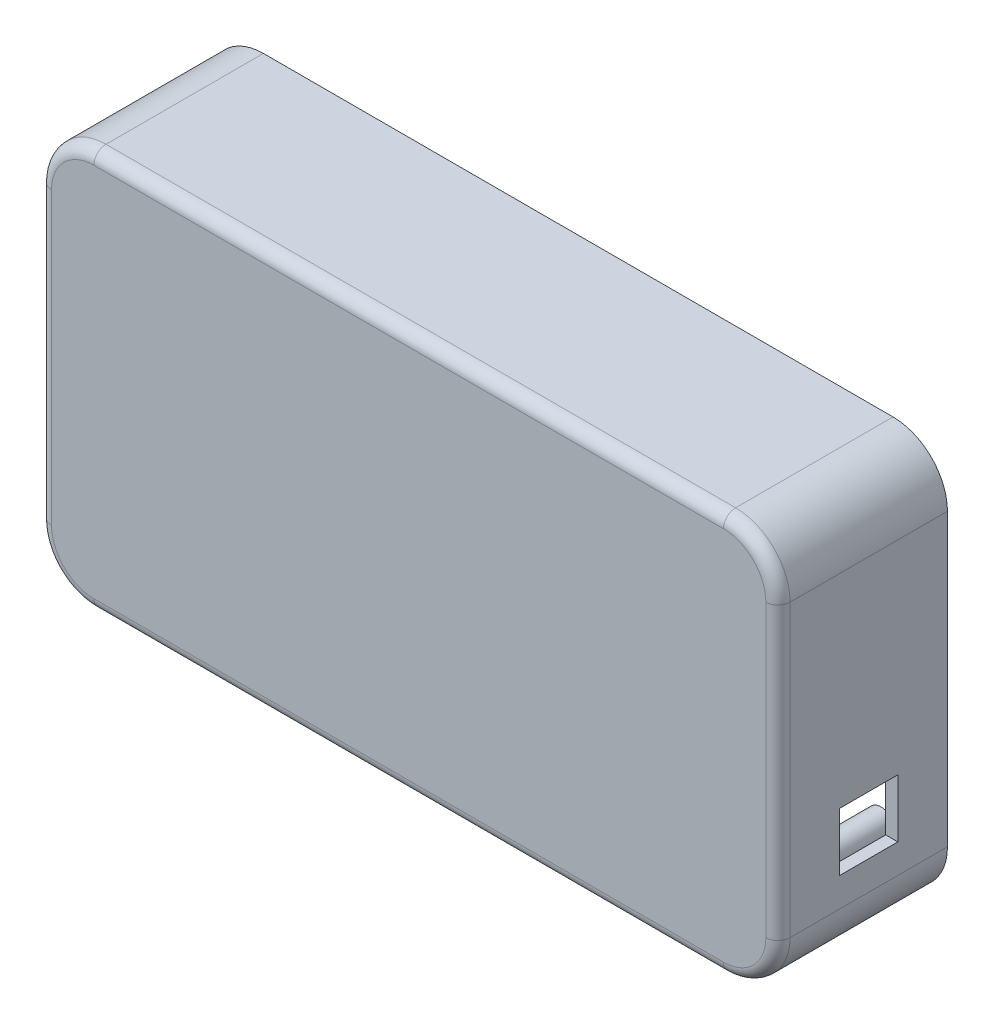
from build123d import *

# Parameters (mm, degrees)
EXTRUDE_1_DEPTH        = 70
SKETCH_1_4_R           = 5.55
CUT_EXTRUDE_1_DEPTH    = 65
CUT_EXTRUDE_2_DEPTH    = 5
SKETCH_1_6_R           = 5.55
SKETCH_1_6_R_2         = 2.55
CUT_EXTRUDE_3_DEPTH    = 5
SKETCH_1_7_R           = 2.55
CUT_EXTRUDE_4_DEPTH    = 40
SKETCH_1_8_R           = 2.55
CUT_EXTRUDE_5_DEPTH    = 40
SKETCH_1_10_R          = 2.55
CUT_EXTRUDE_6_DEPTH    = 40
SKETCH_1_11_R          = 2.55
CUT_EXTRUDE_7_DEPTH    = 40
SKETCH_1_12_R          = 5.55
SKETCH_1_12_R_2        = 2.55
CUT_EXTRUDE_8_DEPTH    = 5
SKETCH_1_13_R          = 5.55
SKETCH_1_13_R_2        = 2.55
CUT_EXTRUDE_9_DEPTH    = 5
SKETCH_1_14_R          = 5.55
SKETCH_1_14_R_2        = 2.55
CUT_EXTRUDE_10_DEPTH   = 5
FILLET_2_R             = 5
SKETCH_14_R            = 1.6
SKETCH_14_W            = 12
SKETCH_14_H            = 7
CUT_EXTRUDE_11_DEPTH   = 5
SKETCH_16_W            = 24
SKETCH_16_H            = 24
CUT_EXTRUDE_12_DEPTH   = 5
SKETCH_18_W            = 24
SKETCH_18_H            = 24
CUT_EXTRUDE_13_DEPTH   = 5
EXTRUDE_2_DEPTH        = 60
SKETCH_28_W            = 0.62195122
SKETCH_28_H            = 3
CUT_EXTRUDE_4121_DEPTH = 1
SKETCH_29_W            = 28.7
SKETCH_29_H            = 26.7
SKETCH_29_W_2          = 25.7
SKETCH_29_H_2          = 23.7
EXTRUDE_3_DEPTH        = 2
SKETCH_29_4_R          = 3
SKETCH_29_4_R_2        = 1.1
EXTRUDE_4_DEPTH        = 5
SKETCH_29_5_R          = 3.1
SKETCH_29_5_R_2        = 1.1
EXTRUDE_5_DEPTH        = 6.5


with BuildPart() as part:
    # 草图1 → 凸台-拉伸1 (new body)
    with BuildSketch(Plane.XY):
        with BuildLine():
            Line((-130, 82.5), (130, 82.5))
            ThreePointArc((130, 82.5), (145.909902577, 75.909902577), (152.5, 60))
            Line((152.5, 60), (152.5, -60))
            ThreePointArc((152.5, -60), (145.909902577, -75.909902577), (130, -82.5))
            Line((130, -82.5), (-130, -82.5))
            ThreePointArc((-130, -82.5), (-145.909902577, -75.909902577), (-152.5, -60))
            Line((-152.5, -60), (-152.5, 60))
            ThreePointArc((-152.5, 60), (-145.909902577, 75.909902577), (-130, 82.5))
        make_face()
    extrude(amount=EXTRUDE_1_DEPTH)

    # 草图1<4> → 切除-拉伸1 (cut)
    with BuildSketch(Plane.XY):
        with BuildLine():
            Line((130, 77.5), (-130, 77.5))
            ThreePointArc((-130, 77.5), (-142.374368671, 72.374368671), (-147.5, 60))
            Line((-147.5, 60), (-147.5, -60))
            ThreePointArc((-147.5, -60), (-142.374368671, -72.374368671), (-130, -77.5))
            Line((-130, -77.5), (130, -77.5))
            ThreePointArc((130, -77.5), (142.374368671, -72.374368671), (147.5, -60))
            Line((147.5, -60), (147.5, 60))
            ThreePointArc((147.5, 60), (142.374368671, 72.374368671), (130, 77.5))
        make_face()
        with Locations((-130, -60)):
            Circle(SKETCH_1_4_R, mode=Mode.SUBTRACT)
        with Locations((130, -60)):
            Circle(SKETCH_1_4_R, mode=Mode.SUBTRACT)
        with Locations((-130, 60)):
            Circle(SKETCH_1_4_R, mode=Mode.SUBTRACT)
        with Locations((130, 60)):
            Circle(SKETCH_1_4_R, mode=Mode.SUBTRACT)
    extrude(amount=CUT_EXTRUDE_1_DEPTH, mode=Mode.SUBTRACT)

    # 草图1<5> → 切除-拉伸2 (cut)
    with BuildSketch(Plane.XY):
        with BuildLine():
            ThreePointArc((-130, 80.2), (-144.28355698, 74.28355698), (-150.2, 60))
            Line((-150.2, 60), (-150.2, -60))
            ThreePointArc((-150.2, -60), (-144.28355698, -74.28355698), (-130, -80.2))
            Line((-130, -80.2), (130, -80.2))
            ThreePointArc((130, -80.2), (144.28355698, -74.28355698), (150.2, -60))
            Line((150.2, -60), (150.2, 60))
            ThreePointArc((150.2, 60), (144.28355698, 74.28355698), (130, 80.2))
            Line((130, 80.2), (-130, 80.2))
        make_face()
        with BuildLine():
            ThreePointArc((-147.5, 60), (-142.374368671, 72.374368671), (-130, 77.5))
            Line((-130, 77.5), (130, 77.5))
            ThreePointArc((130, 77.5), (142.374368671, 72.374368671), (147.5, 60))
            Line((147.5, 60), (147.5, -60))
            ThreePointArc((147.5, -60), (142.374368671, -72.374368671), (130, -77.5))
            Line((130, -77.5), (-130, -77.5))
            ThreePointArc((-130, -77.5), (-142.374368671, -72.374368671), (-147.5, -60))
            Line((-147.5, -60), (-147.5, 60))
        make_face(mode=Mode.SUBTRACT)
    extrude(amount=CUT_EXTRUDE_2_DEPTH, mode=Mode.SUBTRACT)

    # 草图1<6> → 切除-拉伸3 (cut)
    with BuildSketch(Plane.XY):
        with Locations((130, 60)):
            Circle(SKETCH_1_6_R)
        with Locations((130, 60)):
            Circle(SKETCH_1_6_R_2, mode=Mode.SUBTRACT)
    extrude(amount=CUT_EXTRUDE_3_DEPTH, mode=Mode.SUBTRACT)

    # 草图1<7> → 切除-拉伸4 (cut)
    with BuildSketch(Plane.XY):
        with Locations((130, 60)):
            Circle(SKETCH_1_7_R)
    extrude(amount=CUT_EXTRUDE_4_DEPTH, mode=Mode.SUBTRACT)

    # 草图1<8> → 切除-拉伸5 (cut)
    with BuildSketch(Plane.XY):
        with Locations((130, -60)):
            Circle(SKETCH_1_8_R)
    extrude(amount=CUT_EXTRUDE_5_DEPTH, mode=Mode.SUBTRACT)

    # 草图1<10> → 切除-拉伸6 (cut)
    with BuildSketch(Plane.XY):
        with Locations((-130, -60)):
            Circle(SKETCH_1_10_R)
    extrude(amount=CUT_EXTRUDE_6_DEPTH, mode=Mode.SUBTRACT)

    # 草图1<11> → 切除-拉伸7 (cut)
    with BuildSketch(Plane.XY):
        with Locations((-130, 60)):
            Circle(SKETCH_1_11_R)
    extrude(amount=CUT_EXTRUDE_7_DEPTH, mode=Mode.SUBTRACT)

    # 草图1<12> → 切除-拉伸8 (cut)
    with BuildSketch(Plane.XY):
        with Locations((-130, 60)):
            Circle(SKETCH_1_12_R)
        with Locations((-130, 60)):
            Circle(SKETCH_1_12_R_2, mode=Mode.SUBTRACT)
    extrude(amount=CUT_EXTRUDE_8_DEPTH, mode=Mode.SUBTRACT)

    # 草图1<13> → 切除-拉伸9 (cut)
    with BuildSketch(Plane.XY):
        with Locations((-130, -60)):
            Circle(SKETCH_1_13_R)
        with Locations((-130, -60)):
            Circle(SKETCH_1_13_R_2, mode=Mode.SUBTRACT)
    extrude(amount=CUT_EXTRUDE_9_DEPTH, mode=Mode.SUBTRACT)

    # 草图1<14> → 切除-拉伸10 (cut)
    with BuildSketch(Plane.XY):
        with Locations((130, -60)):
            Circle(SKETCH_1_14_R)
        with Locations((130, -60)):
            Circle(SKETCH_1_14_R_2, mode=Mode.SUBTRACT)
    extrude(amount=CUT_EXTRUDE_10_DEPTH, mode=Mode.SUBTRACT)

    # 圆角2
    fillet_2_edges = [part.edges().sort_by_distance(p)[0] for p in [
        (-152.5, 0, 70),
        (0, -82.5, 70),
        (152.5, 0, 70),
        (0, 82.5, 70),
    ]]
    fillet(fillet_2_edges, radius=FILLET_2_R)

    # 草图14 → 切除-拉伸11 (cut)
    with BuildSketch(Plane.XZ.offset(82.5)):
        with Locations((9, 58)):
            Circle(SKETCH_14_R)
        with Locations((-9, 58)):
            Circle(SKETCH_14_R)
        with Locations((0, 58)):
            Rectangle(SKETCH_14_W, SKETCH_14_H)
    extrude(amount=-CUT_EXTRUDE_11_DEPTH, mode=Mode.SUBTRACT)

    # 草图16 → 切除-拉伸12 (cut)
    with BuildSketch(Plane(origin=(152.5, 0, 0), x_dir=(0, 0, -1), z_dir=(1, 0, 0))):
        with Locations((-32.5, -36)):
            Rectangle(SKETCH_16_W, SKETCH_16_H)
    extrude(amount=-CUT_EXTRUDE_12_DEPTH, mode=Mode.SUBTRACT)

    # 草图18 → 切除-拉伸13 (cut)
    with BuildSketch(Plane.ZY.offset(152.5)):
        with Locations((32.5, -36)):
            Rectangle(SKETCH_18_W, SKETCH_18_H)
    extrude(amount=-CUT_EXTRUDE_13_DEPTH, mode=Mode.SUBTRACT)

    # 草图19 → 凸台-拉伸2 (add)
    with BuildSketch(Plane(origin=(0, 0, 65), x_dir=(-1, 0, 0), z_dir=(0, 0, -1))):
        with BuildLine():
            Line((-103, 40), (-18, 40))
            ThreePointArc((-18, 40), (-14, 36), (-18, 32))
            Line((-18, 32), (-103, 32))
            ThreePointArc((-103, 32), (-107, 36), (-103, 40))
        make_face()
        with BuildLine():
            Line((103, 40), (18, 40))
            ThreePointArc((18, 40), (14, 36), (18, 32))
            Line((18, 32), (103, 32))
            ThreePointArc((103, 32), (107, 36), (103, 40))
        make_face()
        with BuildLine():
            Line((-103, -20), (-23, -20))
            ThreePointArc((-23, -20), (-19, -24), (-23, -28))
            Line((-23, -28), (-103, -28))
            ThreePointArc((-103, -28), (-107, -24), (-103, -20))
        make_face()
        with BuildLine():
            Line((103, -20), (23, -20))
            ThreePointArc((23, -20), (19, -24), (23, -28))
            Line((23, -28), (103, -28))
            ThreePointArc((103, -28), (107, -24), (103, -20))
        make_face()
    extrude(amount=EXTRUDE_2_DEPTH)

    # 草图28 → Cut-Extrude 4121 (cut)
    # profile 1 of 6: a face of its own
    with BuildSketch(Plane(origin=(0, 0, 5), x_dir=(-1, 0, 0), z_dir=(0, 0, -1))):
        with BuildLine():
            Line((71.743902439, -23.06097561), (71.743902439, -22))
            Line((71.743902439, -22), (72.402439024, -22))
            Line((72.402439024, -22), (72.402439024, -25))
            Line((72.402439024, -25), (71.366615854, -25))
            add(Edge.make_bspline(
                [(71.366615854, -25), (71.321235516, -24.999503633), (71.233367687, -24.99854254), (71.106060544, -24.986562483), (70.987337132, -24.968820048), (70.877181936, -24.943151197), (70.775581487, -24.910343596), (70.683056103, -24.869429025), (70.598654541, -24.822319695), (70.524024812, -24.766238818), (70.457535573, -24.70359415), (70.399890652, -24.633409047), (70.351643157, -24.555403322), (70.312118811, -24.470154314), (70.281102248, -24.377583496), (70.259827547, -24.277464991), (70.246454511, -24.170330476), (70.244768718, -24.096458902), (70.243902439, -24.058498476)],
                knots=[0, 0, 0, 0, 1.298309684, 2.513856393, 3.656108695, 4.731525363, 5.747269452, 6.706842141, 7.622696522, 8.50723259, 9.371308978, 10.231556582, 11.09863924, 11.989139744, 12.915198226, 13.88644584, 14.913906774, 16, 16, 16, 16], degree=3))
            add(Edge.make_bspline(
                [(70.243902439, -24.058498476), (70.244769405, -24.021272958), (70.246467359, -23.948366695), (70.263337433, -23.842163665), (70.288441674, -23.740985732), (70.326073247, -23.646083274), (70.373267335, -23.556331972), (70.431224137, -23.472633969), (70.500132787, -23.395013177), (70.578100814, -23.323395194), (70.66409143, -23.259035564), (70.756348979, -23.203590213), (70.853782678, -23.156921785), (70.956335147, -23.119131351), (71.06429291, -23.090548423), (71.177535592, -23.071210485), (71.295911317, -23.060851645), (71.376505344, -23.060933819), (71.417492378, -23.06097561)],
                knots=[0, 0, 0, 0, 1.030031435, 2.017318961, 2.9707634, 3.911434012, 4.836705747, 5.773461207, 6.723043161, 7.705184701, 8.700351159, 9.692154612, 10.681034209, 11.68770297, 12.714187277, 13.76904456, 14.865421547, 16, 16, 16, 16], degree=3))
            Line((71.417492378, -23.06097561), (71.743902439, -23.06097561))
        make_face()
        with BuildLine():
            Line((71.761051829, -24.524390244), (71.761051829, -23.536585366))
            Line((71.761051829, -23.536585366), (71.47808689, -23.536585366))
            add(Edge.make_bspline(
                [(71.47808689, -23.536585366), (71.45482084, -23.536778598), (71.40972001, -23.537153174), (71.344465291, -23.543899544), (71.283444982, -23.553252093), (71.227085634, -23.566981838), (71.174809955, -23.583961658), (71.127554347, -23.605656177), (71.084616512, -23.631110707), (71.045811993, -23.66020658), (71.012369871, -23.694182881), (70.982530002, -23.731325445), (70.957217351, -23.772482976), (70.937630493, -23.818149594), (70.921074649, -23.86693942), (70.910829478, -23.92001949), (70.903580084, -23.97674328), (70.902827123, -24.015980331), (70.902439024, -24.036204268)],
                knots=[0, 0, 0, 0, 1.278264899, 2.477894098, 3.602370215, 4.669373304, 5.663063542, 6.619223296, 7.520996807, 8.402964925, 9.276935434, 10.134111266, 11.017943356, 11.922995833, 12.86038281, 13.844364746, 14.88892179, 16, 16, 16, 16], degree=3))
            add(Edge.make_bspline(
                [(70.902439024, -24.036204268), (70.902841845, -24.055853896), (70.903626626, -24.094135534), (70.910737268, -24.14956841), (70.921397479, -24.2015033), (70.936606653, -24.249559353), (70.956924182, -24.293637792), (70.98167517, -24.333929433), (71.010654257, -24.370630426), (71.044706059, -24.402947478), (71.082167237, -24.432460876), (71.125226736, -24.456841362), (71.172201914, -24.478173977), (71.223803805, -24.495139779), (71.279703169, -24.508144403), (71.339844971, -24.517877805), (71.404613583, -24.523603352), (71.449302272, -24.524122343), (71.472370427, -24.524390244)],
                knots=[0, 0, 0, 0, 1.096807385, 2.136813243, 3.115574441, 4.054422268, 4.94474187, 5.818891163, 6.689666352, 7.547538513, 8.435055958, 9.345744162, 10.302983784, 11.312439221, 12.373194966, 13.505006157, 14.712092391, 16, 16, 16, 16], degree=3))
            Line((71.472370427, -24.524390244), (71.761051829, -24.524390244))
        make_face(mode=Mode.SUBTRACT)
    # profile 2 of 6: a face of its own
    with BuildSketch(Plane(origin=(0, 0, 5), x_dir=(-1, 0, 0), z_dir=(0, 0, -1))):
        with BuildLine():
            Line((67.975609756, -23.06097561), (67.975609756, -22))
            Line((67.975609756, -22), (68.634146341, -22))
            Line((68.634146341, -22), (68.634146341, -25))
            Line((68.634146341, -25), (67.598323171, -25))
            add(Edge.make_bspline(
                [(67.598323171, -25), (67.552942833, -24.999503633), (67.465075004, -24.99854254), (67.337767861, -24.986562483), (67.219044449, -24.968820048), (67.108889254, -24.943151197), (67.007288804, -24.910343596), (66.914763421, -24.869429025), (66.830361858, -24.822319695), (66.755732129, -24.766238818), (66.68924289, -24.70359415), (66.631597969, -24.633409047), (66.583350475, -24.555403322), (66.543826128, -24.470154314), (66.512809566, -24.377583496), (66.491534864, -24.277464991), (66.478161828, -24.170330476), (66.476476035, -24.096458902), (66.475609756, -24.058498476)],
                knots=[0, 0, 0, 0, 1.298309684, 2.513856393, 3.656108695, 4.731525363, 5.747269452, 6.706842141, 7.622696522, 8.50723259, 9.371308978, 10.231556582, 11.09863924, 11.989139744, 12.915198226, 13.88644584, 14.913906774, 16, 16, 16, 16], degree=3))
            add(Edge.make_bspline(
                [(66.475609756, -24.058498476), (66.476476722, -24.021272958), (66.478174676, -23.948366695), (66.49504475, -23.842163665), (66.520148991, -23.740985732), (66.557780564, -23.646083274), (66.604974652, -23.556331972), (66.662931454, -23.472633969), (66.731840104, -23.395013177), (66.809808131, -23.323395194), (66.895798747, -23.259035564), (66.988056296, -23.203590213), (67.085489995, -23.156921785), (67.188042464, -23.119131351), (67.296000227, -23.090548423), (67.409242909, -23.071210485), (67.527618634, -23.060851645), (67.608212661, -23.060933819), (67.649199695, -23.06097561)],
                knots=[0, 0, 0, 0, 1.030031435, 2.017318961, 2.9707634, 3.911434012, 4.836705747, 5.773461207, 6.723043161, 7.705184701, 8.700351159, 9.692154612, 10.681034209, 11.68770297, 12.714187277, 13.76904456, 14.865421547, 16, 16, 16, 16], degree=3))
            Line((67.649199695, -23.06097561), (67.975609756, -23.06097561))
        make_face()
        with BuildLine():
            Line((67.992759146, -24.524390244), (67.992759146, -23.536585366))
            Line((67.992759146, -23.536585366), (67.709794207, -23.536585366))
            add(Edge.make_bspline(
                [(67.709794207, -23.536585366), (67.686528157, -23.536778598), (67.641427327, -23.537153174), (67.576172608, -23.543899544), (67.515152299, -23.553252093), (67.458792951, -23.566981838), (67.406517272, -23.583961658), (67.359261664, -23.605656177), (67.316323829, -23.631110707), (67.27751931, -23.66020658), (67.244077188, -23.694182881), (67.21423732, -23.731325445), (67.188924668, -23.772482976), (67.16933781, -23.818149594), (67.152781966, -23.86693942), (67.142536795, -23.92001949), (67.135287401, -23.97674328), (67.13453444, -24.015980331), (67.134146341, -24.036204268)],
                knots=[0, 0, 0, 0, 1.278264899, 2.477894098, 3.602370215, 4.669373304, 5.663063542, 6.619223296, 7.520996807, 8.402964925, 9.276935434, 10.134111266, 11.017943356, 11.922995833, 12.86038281, 13.844364746, 14.88892179, 16, 16, 16, 16], degree=3))
            add(Edge.make_bspline(
                [(67.134146341, -24.036204268), (67.134549162, -24.055853896), (67.135333943, -24.094135534), (67.142444585, -24.14956841), (67.153104796, -24.2015033), (67.16831397, -24.249559353), (67.188631499, -24.293637792), (67.213382487, -24.333929433), (67.242361575, -24.370630426), (67.276413376, -24.402947478), (67.313874554, -24.432460876), (67.356934053, -24.456841362), (67.403909231, -24.478173977), (67.455511122, -24.495139779), (67.511410486, -24.508144403), (67.571552288, -24.517877805), (67.6363209, -24.523603352), (67.681009589, -24.524122343), (67.704077744, -24.524390244)],
                knots=[0, 0, 0, 0, 1.096807385, 2.136813243, 3.115574441, 4.054422268, 4.94474187, 5.818891163, 6.689666352, 7.547538513, 8.435055958, 9.345744162, 10.302983784, 11.312439221, 12.373194966, 13.505006157, 14.712092391, 16, 16, 16, 16], degree=3))
            Line((67.704077744, -24.524390244), (67.992759146, -24.524390244))
        make_face(mode=Mode.SUBTRACT)
    # profile 3 of 6: a face of its own
    with BuildSketch(Plane(origin=(0, 0, 5), x_dir=(-1, 0, 0), z_dir=(0, 0, -1))):
        with BuildLine():
            add(Edge.make_bspline(
                [(62.414634146, -22.213224085), (62.452070051, -22.193187917), (62.527841518, -22.152634072), (62.648133019, -22.102350745), (62.774585243, -22.05927485), (62.907131479, -22.0239713), (63.046138001, -21.996470603), (63.191252582, -21.977327801), (63.342798052, -21.965734339), (63.445863253, -21.964198595), (63.49847561, -21.963414634)],
                knots=[0, 0, 0, 0, 0.905764502, 1.833296254, 2.778524791, 3.755102668, 4.758409924, 5.800558306, 6.877236841, 8, 8, 8, 8], degree=3))
            add(Edge.make_bspline(
                [(63.49847561, -21.963414634), (63.556839145, -21.96454775), (63.670835553, -21.966760968), (63.836943398, -21.986152858), (63.993719198, -22.016521922), (64.141116916, -22.059925766), (64.278749233, -22.116694451), (64.407052913, -22.185703034), (64.526379769, -22.266483507), (64.634860245, -22.360387598), (64.731919866, -22.465090021), (64.817509719, -22.578881528), (64.888988126, -22.70246211), (64.947656755, -22.835126345), (64.993431791, -22.976893338), (65.025628705, -23.127816679), (65.045565532, -23.287764783), (65.047690205, -23.397424433), (65.048780488, -23.453696646)],
                knots=[0, 0, 0, 0, 1.150308723, 2.246797832, 3.292262244, 4.295476905, 5.270793765, 6.222142612, 7.163057208, 8.105964619, 9.044318326, 9.972988713, 10.907280248, 11.852489879, 12.827864619, 13.838828932, 14.890987884, 16, 16, 16, 16], degree=3))
            add(Edge.make_bspline(
                [(65.048780488, -23.453696646), (65.048530483, -23.482672532), (65.048036545, -23.539920604), (65.041708388, -23.624735321), (65.03362696, -23.707589883), (65.021069618, -23.78833163), (65.004096736, -23.86675859), (64.984959854, -23.943611825), (64.961742702, -24.018346382), (64.933738099, -24.090499652), (64.903754949, -24.161214191), (64.869303732, -24.229584847), (64.831701558, -24.296221244), (64.789599371, -24.360211575), (64.744640076, -24.422598495), (64.69571708, -24.482670258), (64.643830011, -24.541219483), (64.569280228, -24.615466914), (64.469289412, -24.701022606), (64.340191728, -24.791769851), (64.200916343, -24.867308437), (64.052546235, -24.929082213), (63.895497251, -24.977948368), (63.729082831, -25.011861738), (63.553704547, -25.03288087), (63.433559377, -25.035332238), (63.372141768, -25.036585366)],
                knots=[0, 0, 0, 0, 0.804008257, 1.588490589, 2.359415033, 3.114115391, 3.85469397, 4.585808504, 5.311740349, 6.024805626, 6.733109078, 7.442635548, 8.148446986, 8.855465972, 9.567392887, 10.281829633, 11.004730757, 11.737679193, 13.200405481, 14.651363498, 16.109186693, 17.588340932, 19.105513233, 20.666480423, 22.295921515, 24, 24, 24, 24], degree=3))
            add(Edge.make_bspline(
                [(63.372141768, -25.036585366), (63.332307494, -25.036127525), (63.253923125, -25.035226604), (63.138196402, -25.028667414), (63.026364894, -25.018882987), (62.918562434, -25.003430009), (62.814165551, -24.985891423), (62.714066411, -24.961919143), (62.617241364, -24.935619047), (62.555138798, -24.913681806), (62.524390244, -24.902820122)],
                knots=[0, 0, 0, 0, 1.108229999, 2.180732801, 3.224212248, 4.230392862, 5.210078469, 6.168137424, 7.092998441, 8, 8, 8, 8], degree=3))
            Line((62.524390244, -24.902820122), (62.524390244, -24.304878049))
            add(Edge.make_bspline(
                [(62.524390244, -24.304878049), (62.55460033, -24.322549461), (62.615441144, -24.35813834), (62.712637652, -24.402388462), (62.814487162, -24.440140421), (62.921290225, -24.471066345), (63.033048477, -24.495027072), (63.149734498, -24.511951309), (63.27133632, -24.522524084), (63.354017598, -24.52376029), (63.396150915, -24.524390244)],
                knots=[0, 0, 0, 0, 0.9220621, 1.85696284, 2.810499976, 3.783315138, 4.785220574, 5.82089063, 6.889553879, 8, 8, 8, 8], degree=3))
            add(Edge.make_bspline(
                [(63.396150915, -24.524390244), (63.432204214, -24.523490586), (63.503031254, -24.521723199), (63.606611102, -24.508474899), (63.70494809, -24.486410493), (63.797665546, -24.45446052), (63.885545474, -24.414718102), (63.967892266, -24.365038309), (64.044703503, -24.306331997), (64.116060234, -24.239598214), (64.180497166, -24.165513913), (64.236864581, -24.085055912), (64.284467205, -23.99879371), (64.323672371, -23.906942801), (64.35302571, -23.809028733), (64.374974334, -23.706036547), (64.387466193, -23.597104625), (64.389302504, -23.522706367), (64.390243902, -23.484565549)],
                knots=[0, 0, 0, 0, 1.068568043, 2.099211781, 3.089950087, 4.051000015, 5.001416445, 5.944011771, 6.895283926, 7.862423631, 8.835401866, 9.800725282, 10.769101412, 11.751137938, 12.755343674, 13.794527825, 14.86934834, 16, 16, 16, 16], degree=3))
            add(Edge.make_bspline(
                [(64.390243902, -23.484565549), (64.389440852, -23.445861629), (64.387878542, -23.370564357), (64.37678652, -23.260887053), (64.356261053, -23.158232526), (64.33005103, -23.061416711), (64.294314012, -22.971553544), (64.251321403, -22.887882731), (64.200332535, -22.810825314), (64.14125388, -22.741183722), (64.075961684, -22.678681463), (64.004763741, -22.623707833), (63.927043141, -22.578274514), (63.844418906, -22.539821541), (63.755461443, -22.511792435), (63.661292275, -22.490316686), (63.561127361, -22.477696777), (63.492413252, -22.476315336), (63.457317073, -22.475609756)],
                knots=[0, 0, 0, 0, 1.192903147, 2.320756001, 3.39190871, 4.416435883, 5.407770308, 6.366507788, 7.31123856, 8.248933498, 9.175230166, 10.092622087, 11.014215195, 11.94450602, 12.89540485, 13.882764997, 14.918608447, 16, 16, 16, 16], degree=3))
            add(Edge.make_bspline(
                [(63.457317073, -22.475609756), (63.416297498, -22.476373932), (63.338008545, -22.477832419), (63.226488874, -22.491844757), (63.126070147, -22.513311921), (63.065490368, -22.537323579), (63.036585366, -22.548780488)],
                knots=[0, 0, 0, 0, 1.144267593, 2.183921005, 3.133477062, 4, 4, 4, 4], degree=3))
            Line((63.036585366, -22.548780488), (63.036585366, -23.170731707))
            Line((63.036585366, -23.170731707), (63.658536585, -23.170731707))
            Line((63.658536585, -23.170731707), (63.658536585, -23.682926829))
            Line((63.658536585, -23.682926829), (62.414634146, -23.682926829))
            Line((62.414634146, -23.682926829), (62.414634146, -22.213224085))
        make_face()
    # profile 4 of 6: a face of its own
    with BuildSketch(Plane(origin=(0, 0, 5), x_dir=(-1, 0, 0), z_dir=(0, 0, -1))):
        Polygon((58.865853659, -22), (60.658536585, -22), (60.658536585, -25), (58.93902439, -25), (58.93902439, -24.487804878), (60.013147866, -24.487804878), (60.013147866, -23.756097561), (59.012195122, -23.756097561), (59.012195122, -23.243902439), (60, -23.243902439), (60, -22.512195122), (58.865853659, -22.512195122), align=None)
    # profile 5 of 6: a face of its own
    with BuildSketch(Plane(origin=(0, 0, 5), x_dir=(-1, 0, 0), z_dir=(0, 0, -1))):
        with BuildLine():
            Line((54.768292683, -22), (55.574885671, -22))
            Line((55.574885671, -22), (56.506669207, -23.311356707))
            add(Edge.make_bspline(
                [(56.506669207, -23.311356707), (56.512861412, -23.320824523), (56.526480191, -23.341647492), (56.546528275, -23.377155315), (56.566652134, -23.420301308), (56.580466032, -23.451387192), (56.587842988, -23.467987805)],
                knots=[0, 0, 0, 0, 0.768222517, 1.689584372, 2.76618222, 4, 4, 4, 4], degree=3))
            Line((56.587842988, -23.467987805), (56.597560976, -23.467987805))
            Line((56.597560976, -23.467987805), (56.597560976, -22))
            Line((56.597560976, -22), (57.219512195, -22))
            Line((57.219512195, -22), (57.219512195, -25))
            Line((57.219512195, -25), (56.597560976, -25))
            Line((56.597560976, -25), (56.597560976, -23.582317073))
            Line((56.597560976, -23.582317073), (56.587842988, -23.582317073))
            add(Edge.make_bspline(
                [(56.587842988, -23.582317073), (56.573652046, -23.611543837), (56.546991461, -23.666452285), (56.515234438, -23.71857224), (56.500381098, -23.742949695)],
                knots=[0, 0, 0, 0, 1.064563444, 2, 2, 2, 2], degree=3))
            Line((56.500381098, -23.742949695), (55.601753049, -25))
            Line((55.601753049, -25), (54.841463415, -25))
            Line((54.841463415, -25), (55.938452744, -23.568597561))
            Line((55.938452744, -23.568597561), (54.768292683, -22))
        make_face()
    # profile 6 of 6: a face of its own
    with BuildSketch(Plane(origin=(0, 0, 5), x_dir=(-1, 0, 0), z_dir=(0, 0, -1))):
        with Locations((52.993902439, -23.5)):
            Rectangle(SKETCH_28_W, SKETCH_28_H)
    extrude(amount=-CUT_EXTRUDE_4121_DEPTH, mode=Mode.SUBTRACT)

    # 草图29 → 凸台-拉伸3 (add)
    with BuildSketch(Plane(origin=(0, 0, 65), x_dir=(-1, 0, 0), z_dir=(0, 0, -1))):
        with Locations((0, -31.85)):
            Rectangle(SKETCH_29_W, SKETCH_29_H)
        with Locations((0, -31.85)):
            Rectangle(SKETCH_29_W_2, SKETCH_29_H_2, mode=Mode.SUBTRACT)
    extrude(amount=EXTRUDE_3_DEPTH)

    # 草图29<4> → 凸台-拉伸4 (add)
    # profile 1 of 2: a face of its own
    with BuildSketch(Plane(origin=(0, 0, 65), x_dir=(-1, 0, 0), z_dir=(0, 0, -1))):
        with Locations((-17.5, -31.85)):
            Circle(SKETCH_29_4_R)
        with Locations((-17.5, -31.85)):
            Circle(SKETCH_29_4_R_2, mode=Mode.SUBTRACT)
    # profile 2 of 2: a face of its own
    with BuildSketch(Plane(origin=(0, 0, 65), x_dir=(-1, 0, 0), z_dir=(0, 0, -1))):
        with Locations((17.5, -31.85)):
            Circle(SKETCH_29_4_R)
        with Locations((17.5, -31.85)):
            Circle(SKETCH_29_4_R_2, mode=Mode.SUBTRACT)
    extrude(amount=EXTRUDE_4_DEPTH)

    # 草图29<5> → 凸台-拉伸5 (add)
    # profile 1 of 4: a face of its own
    with BuildSketch(Plane(origin=(0, 0, 65), x_dir=(-1, 0, 0), z_dir=(0, 0, -1))):
        with Locations((-30, 20)):
            Circle(SKETCH_29_5_R)
        with Locations((-30, 20)):
            Circle(SKETCH_29_5_R_2, mode=Mode.SUBTRACT)
    # profile 2 of 4: a face of its own
    with BuildSketch(Plane(origin=(0, 0, 65), x_dir=(-1, 0, 0), z_dir=(0, 0, -1))):
        with Locations((30, 20)):
            Circle(SKETCH_29_5_R)
        with Locations((30, 20)):
            Circle(SKETCH_29_5_R_2, mode=Mode.SUBTRACT)
    # profile 3 of 4: a face of its own
    with BuildSketch(Plane(origin=(0, 0, 65), x_dir=(-1, 0, 0), z_dir=(0, 0, -1))):
        with Locations((30, -10)):
            Circle(SKETCH_29_5_R)
        with Locations((30, -10)):
            Circle(SKETCH_29_5_R_2, mode=Mode.SUBTRACT)
    # profile 4 of 4: a face of its own
    with BuildSketch(Plane(origin=(0, 0, 65), x_dir=(-1, 0, 0), z_dir=(0, 0, -1))):
        with Locations((-30, -10)):
            Circle(SKETCH_29_5_R)
        with Locations((-30, -10)):
            Circle(SKETCH_29_5_R_2, mode=Mode.SUBTRACT)
    extrude(amount=EXTRUDE_5_DEPTH)


solid = part.part
